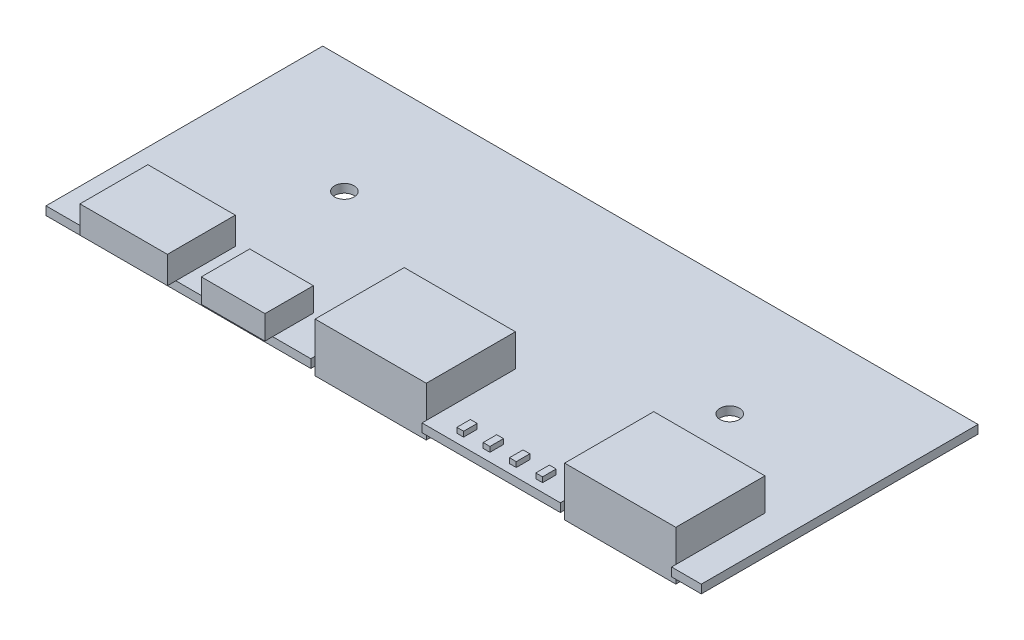
from build123d import *

# Parameters (mm, degrees)
SKETCH1_W                = 77.2
SKETCH1_H                = 32.6
BOSS_EXTRUDE1_DEPTH      = 1
BOSS_EXTRUDE2_DEPTH      = 3.8
BOSS_EXTRUDE2_DEPTH_BACK = 2
SKETCH2_W                = 13.1
SKETCH2_H                = 11
SKETCH3_W                = 7.5
SKETCH3_H                = 5.7
BOSS_EXTRUDE3_DEPTH      = 2.8
SKETCH4_W                = 10.3
SKETCH4_H                = 8
BOSS_EXTRUDE4_DEPTH      = 3.2
SKETCH5_W                = 13.1
SKETCH5_H                = 5.8
CUT_EXTRUDE1_DEPTH       = 0.5
SKETCH6_W                = 0.8
SKETCH6_H                = 1.6
BOSS_EXTRUDE5_DEPTH      = 0.6
LPATTERN1_COUNT          = 4
LPATTERN1_PITCH          = 3.1
SKETCH7_W                = 5.1
SKETCH7_H                = 5.1
BOSS_EXTRUDE6_DEPTH      = 1.3
SKETCH8_R                = 1
BOSS_EXTRUDE7_DEPTH      = 1.2
FILLET1_R                = 1
FILLET2_R                = 0.5
FILLET3_R                = 0.1
SKETCH9_R                = 1.15
CUT_EXTRUDE2_DEPTH       = 43.469871674


with BuildPart() as part:
    # Sketch1 → Boss-Extrude1 (new body)
    with BuildSketch(Plane(origin=(0, 0, 0), x_dir=(1, 0, 0), z_dir=(0, 1, 0))):
        Rectangle(SKETCH1_W, SKETCH1_H)
    extrude(amount=BOSS_EXTRUDE1_DEPTH)

    # Sketch2 → Boss-Extrude2 (add, two sides: drawn at the far end of the back side and taken through both)
    with BuildSketch(Plane(origin=(0, 1, 0), x_dir=(1, 0, 0), z_dir=(0, 1, 0)).offset(-BOSS_EXTRUDE2_DEPTH_BACK)):
        with Locations((28.55, -10.8)):
            Rectangle(SKETCH2_W, SKETCH2_H)
        with Locations((-0.85, -10.8)):
            Rectangle(SKETCH2_W, SKETCH2_H)
    extrude(amount=BOSS_EXTRUDE2_DEPTH + BOSS_EXTRUDE2_DEPTH_BACK)

    # Sketch3 → Boss-Extrude3 (add)
    with BuildSketch(Plane(origin=(0, 1, 0), x_dir=(1, 0, 0), z_dir=(0, 1, 0))):
        with Locations((-15.65, -14.35)):
            Rectangle(SKETCH3_W, SKETCH3_H)
    extrude(amount=BOSS_EXTRUDE3_DEPTH)

    # Sketch4 → Boss-Extrude4 (add)
    with BuildSketch(Plane(origin=(0, 1, 0), x_dir=(1, 0, 0), z_dir=(0, 1, 0))):
        with Locations((-28.45, -13.3)):
            Rectangle(SKETCH4_W, SKETCH4_H)
    extrude(amount=BOSS_EXTRUDE4_DEPTH)

    # Sketch5 → Cut-Extrude1 (cut)
    with BuildSketch(Plane.XY.offset(16.3)):
        with Locations((-0.85, 1.9)):
            Rectangle(SKETCH5_W, SKETCH5_H)
        with Locations((28.55, 1.9)):
            Rectangle(SKETCH5_W, SKETCH5_H)
    extrude(amount=-CUT_EXTRUDE1_DEPTH, mode=Mode.SUBTRACT)

    # Sketch6 → Boss-Extrude5 (add)
    with BuildSketch(Plane(origin=(0, 1, 0), x_dir=(1, 0, 0), z_dir=(0, 1, 0))):
        with Locations((18.5, -14.5)):
            Rectangle(SKETCH6_W, SKETCH6_H)
    boss_extrude5 = extrude(amount=BOSS_EXTRUDE5_DEPTH)

    # LPattern1: Boss-Extrude5 ×4
    with Locations(*[(-i * LPATTERN1_PITCH, 0, 0) for i in range(1, LPATTERN1_COUNT)]):
        add(boss_extrude5)

    # Sketch7 → Boss-Extrude6 (add)
    with BuildSketch(Plane.XZ):
        with Locations((-0.15, -2.85)):
            Rectangle(SKETCH7_W, SKETCH7_H)
    extrude(amount=BOSS_EXTRUDE6_DEPTH)

    # Sketch8 → Boss-Extrude7 (add)
    with BuildSketch(Plane.XZ.offset(1.3)):
        with Locations(Location((-0.15, -2.85, 0), (0, 0, 90))):
            Circle(SKETCH8_R)
    extrude(amount=BOSS_EXTRUDE7_DEPTH)

    # Fillet1
    fillet1_edges = [part.edges().sort_by_distance(p)[0] for p in [
        (-2.7, -0.65, -0.3),
        (-2.7, -0.65, -5.4),
        (2.4, -0.65, -5.4),
        (2.4, -0.65, -0.3),
    ]]
    fillet(fillet1_edges, radius=FILLET1_R)

    # Fillet2
    fillet2_edges = [part.edges().sort_by_distance(p)[0] for p in [
        (-2.7, -1.3, -2.85),
        (-0.15, -1.3, -0.3),
        (-0.15, -1.3, -5.4),
        (2.4, -1.3, -2.85),
        (2.107106781, -1.3, -0.592893219),
        (-2.407106781, -1.3, -5.107106781),
        (2.107106781, -1.3, -5.107106781),
        (-2.407106781, -1.3, -0.592893219),
    ]]
    fillet(fillet2_edges, radius=FILLET2_R)

    # Fillet3
    fillet3_edges = [part.edges().sort_by_distance(p)[0] for p in [
        (-0.15, -2.5, -3.85),
    ]]
    fillet(fillet3_edges, radius=FILLET3_R)

    # Sketch9 → Cut-Extrude2 (cut, through all)
    with BuildSketch(Plane(origin=(0, 1, 0), x_dir=(1, 0, 0), z_dir=(0, 1, 0))):
        with Locations(Location((-22.5, 2.75, 0), (0, 0, 270))):
            Circle(SKETCH9_R)
        with Locations(Location((22.9, 2.75, 0), (0, 0, 270))):
            Circle(SKETCH9_R)
    extrude(amount=-CUT_EXTRUDE2_DEPTH, mode=Mode.SUBTRACT)


solid = part.part
